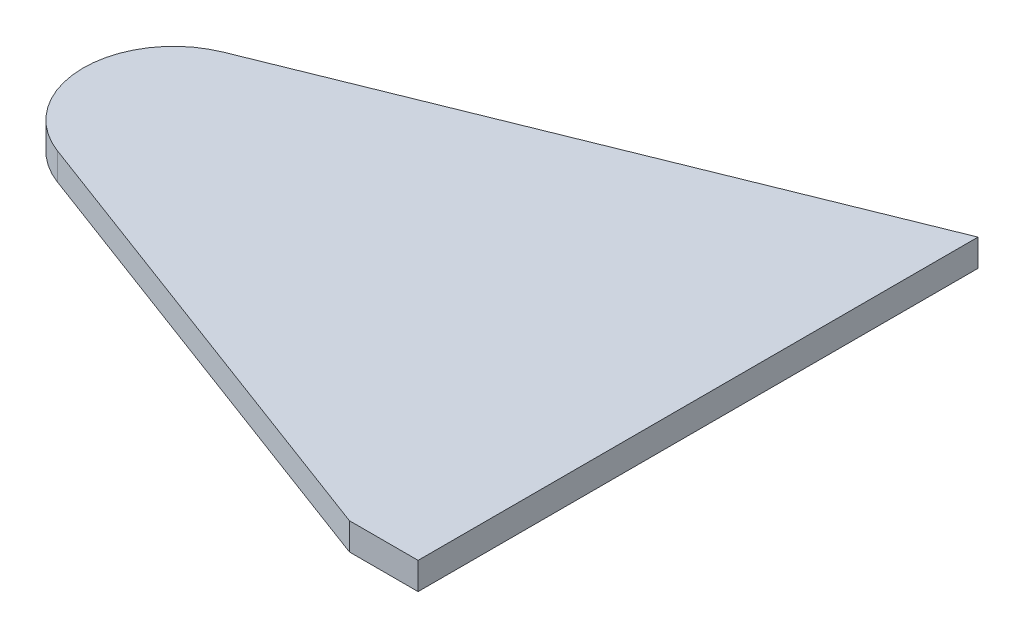
from build123d import *

# Parameters (mm, degrees)
BOSS_EXTRUDE1_DEPTH = 15
FILLET1_R           = 50


with BuildPart() as part:
    # Sketch1 → Boss-Extrude1 (new body)
    with BuildSketch(Plane(origin=(0, 0, 0), x_dir=(1, 0, 0), z_dir=(0, 1, 0))):
        Polygon((0, 0), (38, 0), (38, 310), (-258.698833461, 190.125890107), (-378.767030264, 141.61518971), (-262.26821299, 98.058066753), align=None)
    extrude(amount=BOSS_EXTRUDE1_DEPTH)

    # Fillet1
    fillet1_edges = [part.edges().sort_by_distance(p)[0] for p in [
        (-378.767030264, 7.5, -141.61518971),
    ]]
    fillet(fillet1_edges, radius=FILLET1_R)


solid = part.part
